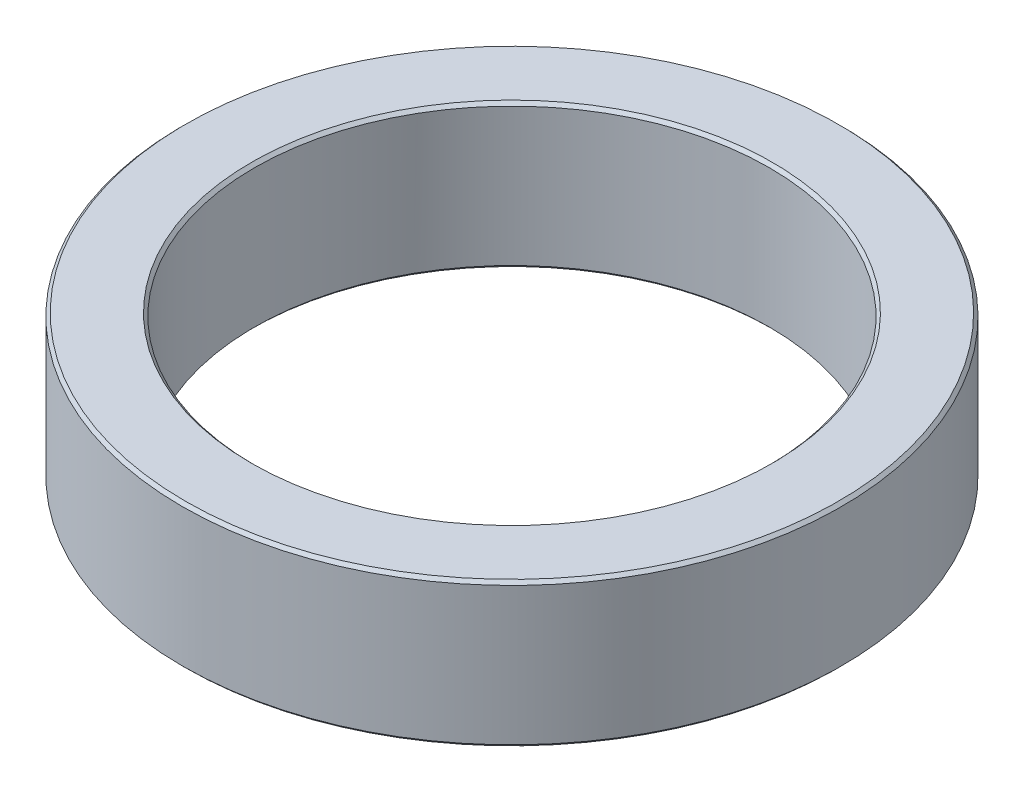
from build123d import *

# Parameters (mm, degrees)
SKETCH1_R           = 16
SKETCH1_R_2         = 12.5
BOSS_EXTRUDE1_DEPTH = 7
CHAMFER1_SIZE       = 0.15


with BuildPart() as part:
    # Sketch1 → Boss-Extrude1 (new body)
    with BuildSketch(Plane(origin=(0, 0, 0), x_dir=(1, 0, 0), z_dir=(0, 1, 0))):
        with Locations(Location((0, 0, 0), (0, 0, 270))):
            Circle(SKETCH1_R)
        with Locations(Location((0, 0, 0), (0, 0, 270))):
            Circle(SKETCH1_R_2, mode=Mode.SUBTRACT)
    extrude(amount=BOSS_EXTRUDE1_DEPTH)

    # Chamfer1
    chamfer1_edges = [part.edges().sort_by_distance(p)[0] for p in [
        (0, 0, -16),
        (0, 7, -16),
        (0, 0, -12.5),
        (0, 7, -12.5),
    ]]
    chamfer(chamfer1_edges, length=CHAMFER1_SIZE)


solid = part.part
